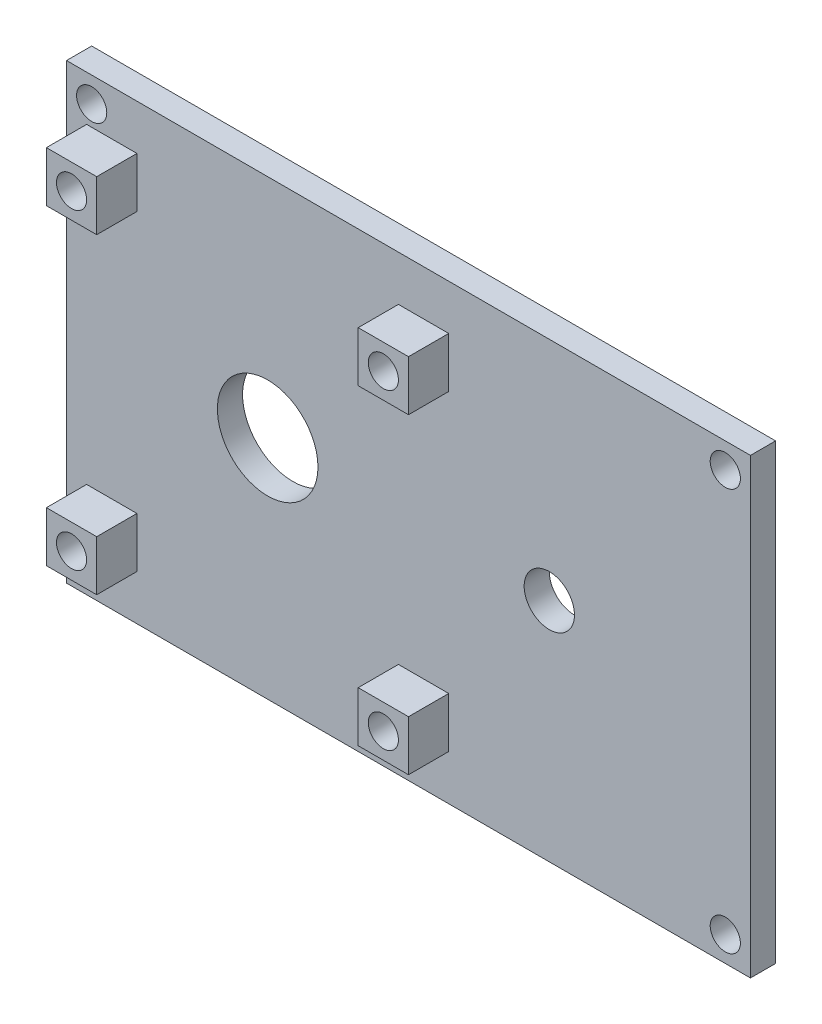
from build123d import *

# Parameters (mm, degrees)
SKICA1_W                 = 68
SKICA1_H                 = 45
SKICA1_R                 = 1.5
SKICA1_R_2               = 5
SKICA1_R_3               = 2.5
P_IDAT_VYSUNUT_M1_DEPTH  = 2.5
SKICA2_W                 = 5
SKICA2_H                 = 5
SKICA2_R                 = 1.5
P_IDAT_VYSUNUT_M2_DEPTH  = 4
ODEBRAT_START            = -2.5
SKICA5_R                 = 1.5
ODEBRAT_VYSUNUT_M1_DEPTH = 2.5
ZKOSEN_1_SIZE            = 1.5


with BuildPart() as part:
    # Skica1 → Přidat vysunutím1 (new body)
    with BuildSketch(Plane.XY):
        Rectangle(SKICA1_W, SKICA1_H)
        with Locations((-31.5, 20)):
            Circle(SKICA1_R, mode=Mode.SUBTRACT)
        with Locations((31.5, 20)):
            Circle(SKICA1_R, mode=Mode.SUBTRACT)
        with Locations((31.5, -20)):
            Circle(SKICA1_R, mode=Mode.SUBTRACT)
        with Locations((-31.5, -20)):
            Circle(SKICA1_R, mode=Mode.SUBTRACT)
        with Locations((-14, 0)):
            Circle(SKICA1_R_2, mode=Mode.SUBTRACT)
        with Locations((14, 0)):
            Circle(SKICA1_R_3, mode=Mode.SUBTRACT)
    extrude(amount=P_IDAT_VYSUNUT_M1_DEPTH)

    # Skica2 → Přidat vysunutím2 (add)
    # profile 1 of 4: a face of its own
    with BuildSketch(Plane.XY.offset(2.5)):
        with Locations((-29.5, 15.5)):
            Rectangle(SKICA2_W, SKICA2_H)
        with Locations((-29.5, 15.5)):
            Circle(SKICA2_R, mode=Mode.SUBTRACT)
    # profile 2 of 4: a face of its own
    with BuildSketch(Plane.XY.offset(2.5)):
        with Locations((1.5, 15.5)):
            Rectangle(SKICA2_W, SKICA2_H)
        with Locations((1.5, 15.5)):
            Circle(SKICA2_R, mode=Mode.SUBTRACT)
    # profile 3 of 4: a face of its own
    with BuildSketch(Plane.XY.offset(2.5)):
        with Locations((1.5, -15.5)):
            Rectangle(SKICA2_W, SKICA2_H)
        with Locations((1.5, -15.5)):
            Circle(SKICA2_R, mode=Mode.SUBTRACT)
    # profile 4 of 4: a face of its own
    with BuildSketch(Plane.XY.offset(2.5)):
        with Locations((-29.5, -15.5)):
            Rectangle(SKICA2_W, SKICA2_H)
        with Locations((-29.5, -15.5)):
            Circle(SKICA2_R, mode=Mode.SUBTRACT)
    extrude(amount=P_IDAT_VYSUNUT_M2_DEPTH)

    # Skica5 → Odebrat vysunutím1 (cut)
    with BuildSketch(Plane.XY.offset(2.5).offset(ODEBRAT_START)):
        with Locations((-29.5, 15.5)):
            Circle(SKICA5_R)
        with Locations((1.5, 15.5)):
            Circle(SKICA5_R)
        with Locations((1.5, -15.5)):
            Circle(SKICA5_R)
        with Locations((-29.5, -15.5)):
            Circle(SKICA5_R)
    extrude(amount=ODEBRAT_VYSUNUT_M1_DEPTH, mode=Mode.SUBTRACT)

    # Zkosení1
    zkosen_1_edges = [part.edges().sort_by_distance(p)[0] for p in [
        (0, -15.5, 0),
        (0, 15.5, 0),
        (-31, 15.5, 0),
        (-31, -15.5, 0),
    ]]
    chamfer(zkosen_1_edges, length=ZKOSEN_1_SIZE)


solid = part.part
